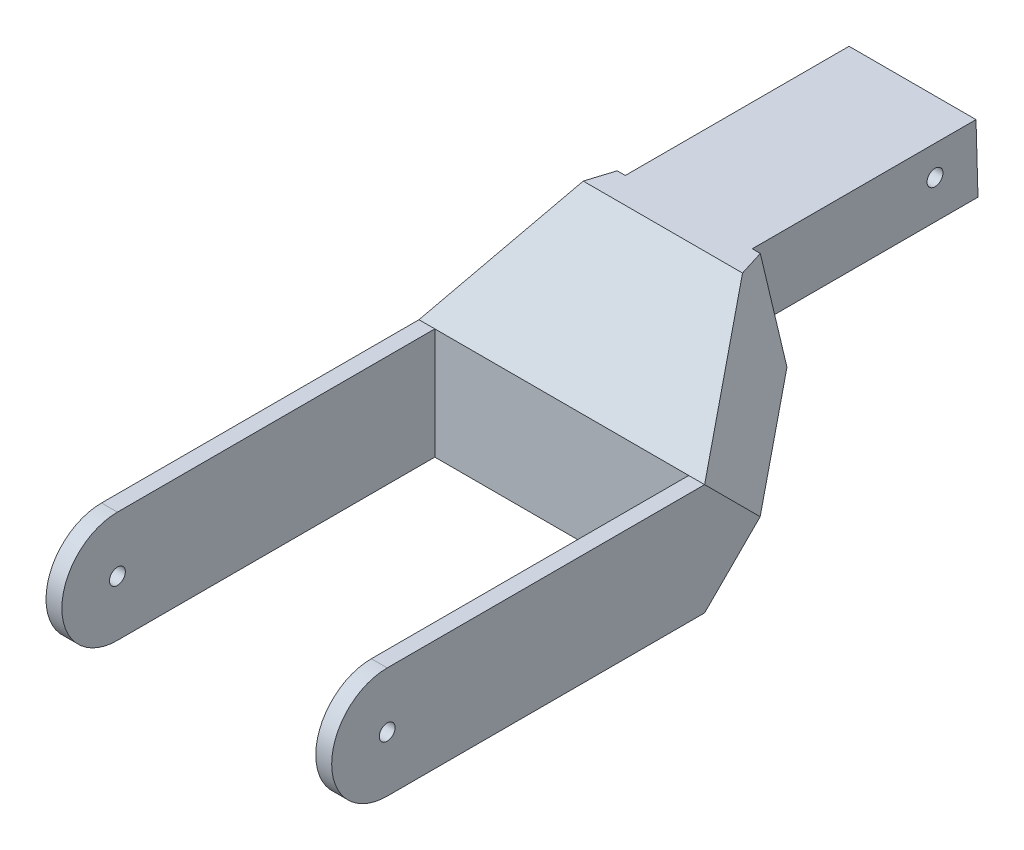
from build123d import *

# Parameters (mm, degrees)
SKETCH_1_W               = 20
SKETCH_1_H               = 10
EXTRUDE_1_DEPTH          = 9
CUT_EXTRUDE_3_DEPTH      = 9
CUT_EXTRUDE_4_DEPTH      = 18.52868966
CUT_EXTRUDE_4_DEPTH_BACK = 9
EXTRUDE_2_DEPTH          = 9
EXTRUDE_3_DEPTH          = 9
SKETCH_10_W              = 8
SKETCH_10_H              = 13
CUT_EXTRUDE_5_DEPTH      = 9
SKETCH_12_W              = 2.5
SKETCH_12_H              = 12
CUT_EXTRUDE_6_DEPTH      = 9
SKETCH_13_W              = 2.5
SKETCH_13_H              = 7.75
CUT_EXTRUDE_7_DEPTH      = 9
CUT_EXTRUDE_8_DEPTH      = 9
CUT_EXTRUDE_9_DEPTH      = 9
SKETCH_26_R              = 0.25
CUT_EXTRUDE_16_DEPTH     = 19.638541659
SCALE_1_SCALE            = 2.454545455
SKETCH_29_W              = 19.36913475
SKETCH_29_H              = 8.233667945
CUT_EXTRUDE_17_DEPTH     = 35.391743647
CUT_EXTRUDE_18_DEPTH     = 10
SKETCH_34_R              = 0.615
CUT_EXTRUDE_19_DEPTH     = 10
CUT_EXTRUDE_20_DEPTH     = 10


with BuildPart() as part:
    # 草图1 → 凸台-拉伸1 (new body)
    with BuildSketch(Plane(origin=(0, 0, 0), x_dir=(0, 0, -1), z_dir=(1, 0, 0))):
        with Locations((-3.964524465, 0.58990319)):
            Rectangle(SKETCH_1_W, SKETCH_1_H)
    extrude(amount=EXTRUDE_1_DEPTH)

    # 草图2 → 切除-拉伸3 (cut)
    with BuildSketch(Plane(origin=(9, 0, 0), x_dir=(0, 0, -1), z_dir=(1, 0, 0))):
        Polygon((0.035475535, -0.41009681), (-3.964524465, -4.41009681), (6.035475535, -4.41009681), (6.035475535, -0.410096535), align=None)
    extrude(amount=-CUT_EXTRUDE_3_DEPTH, mode=Mode.SUBTRACT)

    # 草图6 → 切除-拉伸4 (cut, two sides: drawn at the far end of the back side and taken through both)
    with BuildSketch(Plane(origin=(9, 0, 0), x_dir=(0, 0, -1), z_dir=(1, 0, 0)).offset(-CUT_EXTRUDE_4_DEPTH_BACK)):
        Polygon((-66.684543288, -0.910096672), (-13.964524465, -0.910096672), (-3.964524465, -0.910096672), (0.035475535, 3.089903328), (6.035475535, 3.089903328), (58.755494358, 3.089903328), (55.394957379, 108.476374614), (-70.045080267, 104.476374614), align=None)
    extrude(amount=CUT_EXTRUDE_4_DEPTH + CUT_EXTRUDE_4_DEPTH_BACK, mode=Mode.SUBTRACT)

    # 草图8 → 凸台-拉伸2 (add)
    with BuildSketch(Plane(origin=(9, 0, 0), x_dir=(0, 0, -1), z_dir=(1, 0, 0))):
        with BuildLine():
            Line((-13.964524465, -4.41009681), (-13.964524465, -0.910096672))
            ThreePointArc((-13.964524465, -0.910096672), (-15.714524534, -2.660096741), (-13.964524465, -4.41009681))
        make_face()
    extrude(amount=-EXTRUDE_2_DEPTH)

    # 草图9 → 凸台-拉伸3 (add)
    with BuildSketch(Plane(origin=(9, 0, 0), x_dir=(0, 0, -1), z_dir=(1, 0, 0))):
        with BuildLine():
            Line((6.035475535, -0.410096672), (6.035475535, 3.089903328))
            ThreePointArc((6.035475535, 3.089903328), (7.785475535, 1.339903328), (6.035475535, -0.410096672))
        make_face()
    extrude(amount=-EXTRUDE_3_DEPTH)

    # 草图10 → 切除-拉伸5 (cut)
    with BuildSketch(Plane(origin=(0, -0.910096672, 0), x_dir=(1, 0, 0), z_dir=(0, 1, 0))):
        with Locations((4.5, -10.464524465)):
            Rectangle(SKETCH_10_W, SKETCH_10_H)
    extrude(amount=-CUT_EXTRUDE_5_DEPTH, mode=Mode.SUBTRACT)

    # 草图12 → 切除-拉伸6 (cut)
    with BuildSketch(Plane(origin=(0, 3.089903328, 0), x_dir=(1, 0, 0), z_dir=(0, 1, 0))):
        with Locations((7.75, 6.035475535)):
            Rectangle(SKETCH_12_W, SKETCH_12_H)
    extrude(amount=-CUT_EXTRUDE_6_DEPTH, mode=Mode.SUBTRACT)

    # 草图13 → 切除-拉伸7 (cut)
    with BuildSketch(Plane(origin=(0, 3.089903328, 0), x_dir=(1, 0, 0), z_dir=(0, 1, 0))):
        with Locations((1.25, 3.910475535)):
            Rectangle(SKETCH_13_W, SKETCH_13_H)
    extrude(amount=-CUT_EXTRUDE_7_DEPTH, mode=Mode.SUBTRACT)

    # 草图14 → 切除-拉伸8 (cut)
    with BuildSketch(Plane(origin=(0, 1.527213896, 1.527213896), x_dir=(1, 0, 0), z_dir=(0, 0.7071067811865477, 0.7071067811865475))):
        Polygon((2.5, 2.209976588), (0, -3.446877662), (-6.872938914, -0.617067375), (-4.372938914, 5.039786874), align=None)
    extrude(amount=-CUT_EXTRUDE_8_DEPTH, mode=Mode.SUBTRACT)

    # 草图15 → 切除-拉伸9 (cut)
    with BuildSketch(Plane(origin=(0, 1.527213896, 1.527213896), x_dir=(1, 0, 0), z_dir=(0, 0.7071067811865477, 0.7071067811865475))):
        Polygon((6.5, 2.209976588), (9, -3.446877662), (12.673354488, 0), (10.173354488, 5.656854249), align=None)
    extrude(amount=-CUT_EXTRUDE_9_DEPTH, mode=Mode.SUBTRACT)

    # 草图26 → 切除-拉伸16 (cut, through all)
    with BuildSketch(Plane.ZY):
        with Locations((13.964524465, -2.660096741)):
            Circle(SKETCH_26_R)
    extrude(amount=-CUT_EXTRUDE_16_DEPTH, mode=Mode.SUBTRACT)


with BuildPart() as part_1:
    # 缩放比例1: scaled about (4.5, -0.253377538, 0.893630972)
    add(part.part.scale(SCALE_1_SCALE).moved(Location((-6.545454545, 0.368549146, -1.299826868))))

    # 草图29 → 切除-拉伸17 (cut, through all)
    with BuildSketch(Plane.XY.offset(8.431278652)):
        with Locations((4.462607848, 10.069691287)):
            Rectangle(SKETCH_29_W, SKETCH_29_H)
    extrude(amount=-CUT_EXTRUDE_17_DEPTH, mode=Mode.SUBTRACT)

    # 草图31 → 切除-拉伸18 (cut)
    with BuildSketch(Plane(origin=(9.409090909, 0, 0), x_dir=(0, 0, -1), z_dir=(1, 0, 0))):
        with BuildLine():
            Line((19.210193521, 0.679886253), (1.386903166, 0.679886253))
            Line((1.386903166, 0.679886253), (1.386903166, -0.638052115))
            Line((1.386903166, -0.638052115), (16.114175893, -0.638051777))
            ThreePointArc((16.114175893, -0.638051777), (17.796606115, -0.29485713), (19.210193521, 0.679886253))
        make_face()
    extrude(amount=-CUT_EXTRUDE_18_DEPTH, mode=Mode.SUBTRACT)

    # 草图34 → 切除-拉伸19 (cut)
    with BuildSketch(Plane(origin=(9.409090909, 0, 0), x_dir=(0, 0, -1), z_dir=(1, 0, 0))):
        with Locations((15.522596163, 3.658191587)):
            Circle(SKETCH_34_R)
    extrude(amount=-CUT_EXTRUDE_19_DEPTH, mode=Mode.SUBTRACT)

    # 草图35 → 切除-拉伸20 (cut)
    with BuildSketch(Plane(origin=(9.409090909, 0, 0), x_dir=(0, 0, -1), z_dir=(1, 0, 0))):
        Polygon((18.603278237, 9.002231919), (19.169117802, -10.424926464), (26.96512958, -9.984829025), (26.399290016, 9.442329358), align=None)
    extrude(amount=-CUT_EXTRUDE_20_DEPTH, mode=Mode.SUBTRACT)


solid = part_1.part
